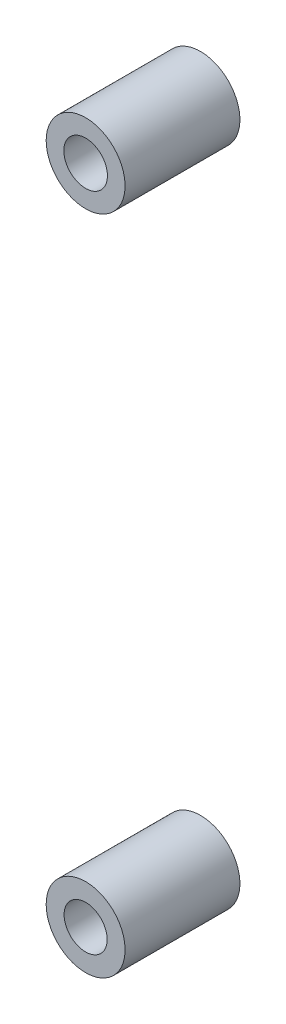
from build123d import *

# Parameters (mm, degrees)
EXTRUDE_START     = -41.800416
SKETCH_1_R        = 2.75
SKETCH_1_R_2      = 1.52
EXTRUDE_1_DEPTH   = 8
SKETCH_1_R_3      = 1.5
EXTRUDE_1_2_DEPTH = 8


with BuildPart() as part:
    # 草图1 → 凸台-拉伸1 (new body)
    with BuildSketch(Plane.XY.offset(EXTRUDE_START)):
        with Locations(Location((-24.698490112, 21.537847164, 0), (0, 0, 180))):
            Circle(SKETCH_1_R)
        with Locations(Location((-24.698490112, 21.537847164, 0), (0, 0, 180))):
            Circle(SKETCH_1_R_2, mode=Mode.SUBTRACT)
    extrude(amount=-EXTRUDE_1_DEPTH)


with BuildPart() as body_2:
    # 草图1 → Extrude 1 2 (new body)
    with BuildSketch(Plane.XY.offset(EXTRUDE_START)):
        with Locations(Location((-24.698490112, -24.562152076, 0), (0, 0, 180))):
            Circle(SKETCH_1_R)
        with Locations(Location((-24.698490112, -24.562152076, 0), (0, 0, 180))):
            Circle(SKETCH_1_R_3, mode=Mode.SUBTRACT)
    extrude(amount=-EXTRUDE_1_2_DEPTH)


solid = Compound([part.part, body_2.part])
